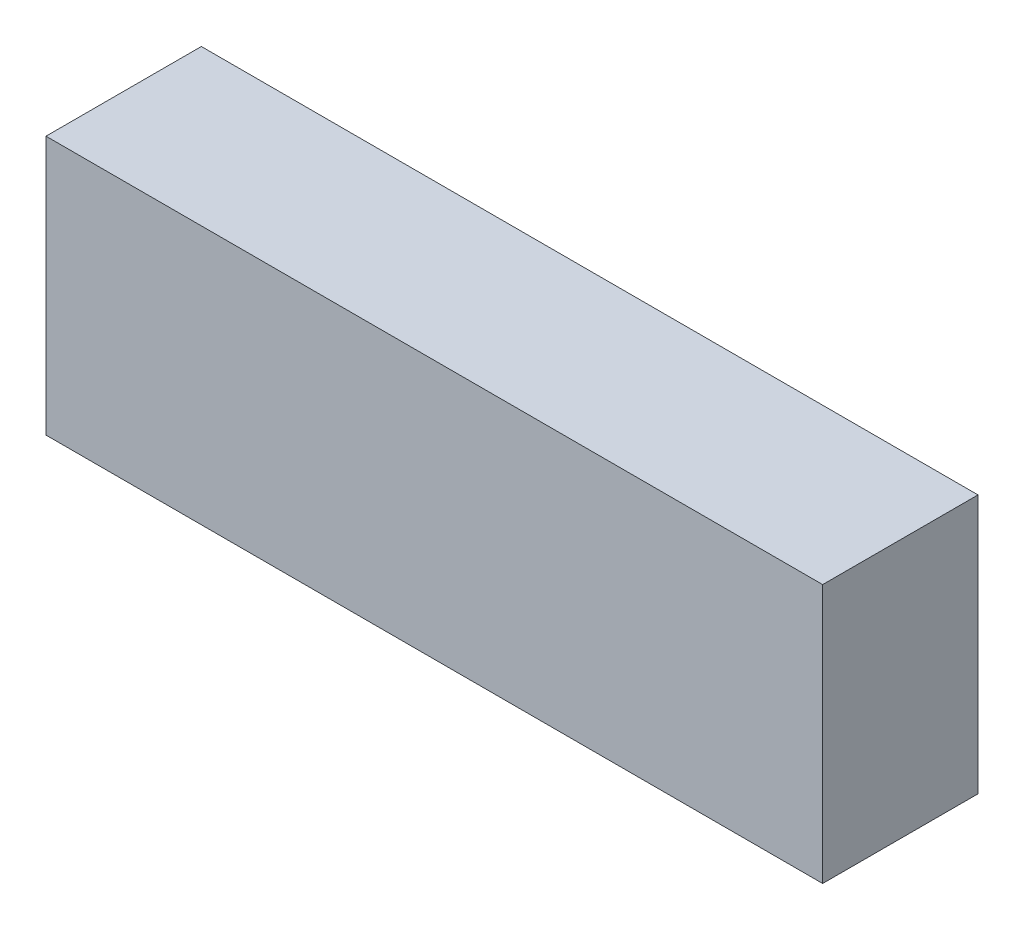
from build123d import *

# Parameters (mm, degrees)
SKETCH1_W           = 30
SKETCH1_H           = 10
BOSS_EXTRUDE1_DEPTH = 6


with BuildPart() as part:
    # Sketch1 → Boss-Extrude1 (new body)
    with BuildSketch(Plane.XY):
        with Locations((15, 5)):
            Rectangle(SKETCH1_W, SKETCH1_H)
    extrude(amount=BOSS_EXTRUDE1_DEPTH)


solid = part.part
